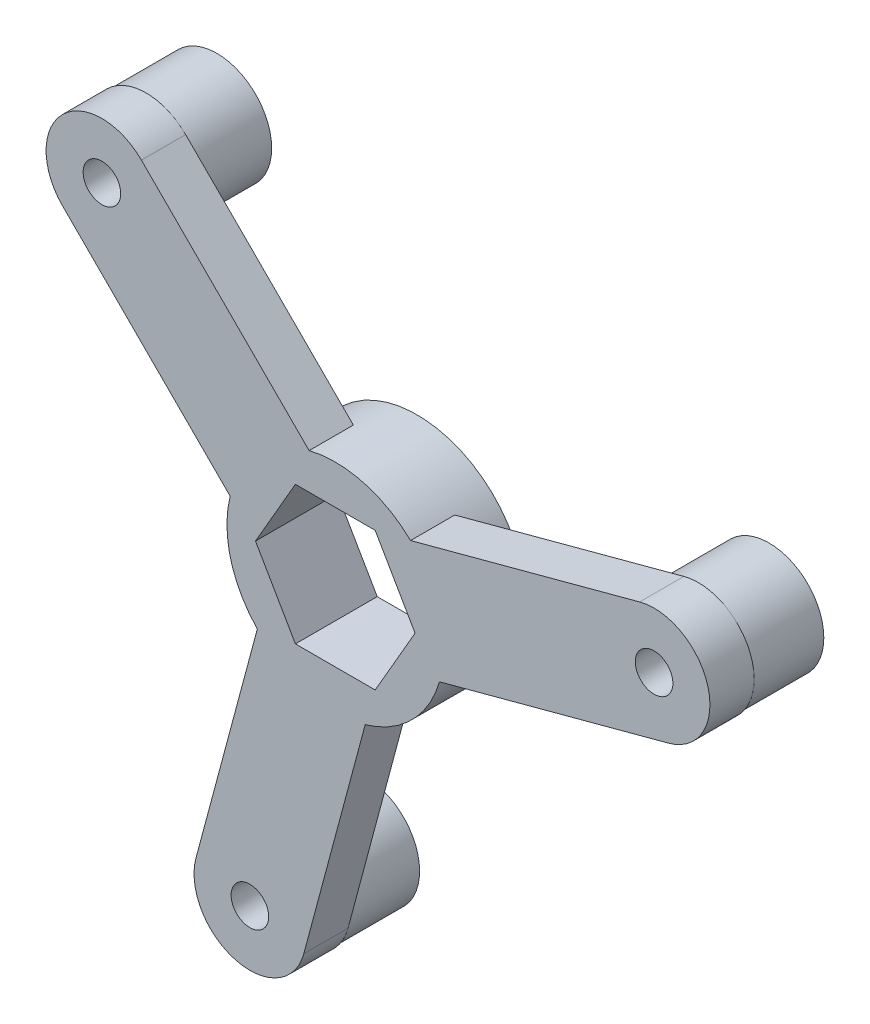
from build123d import *

# Parameters (mm, degrees)
F_01_START                                = 3
S01_HEX_COUPLING_BOSS_R                   = 9.8
F_01_HEX_COUPLING_BOSS_DEPTH              = 7.4
F_02_START                                = 6.4
F_02_DRIVE_SPOKE_1_DEPTH                  = 4
S03_FLANGE_STANDOFF_1_R                   = 4.95
F_03_FLANGE_STANDOFF_1_DEPTH              = 6.4
F_04_START                                = 6.4
F_04_DRIVE_SPOKE_2_DEPTH                  = 4
S05_FLANGE_STANDOFF_2_R                   = 4.95
F_05_FLANGE_STANDOFF_2_DEPTH              = 6.4
F_06_START                                = 6.4
F_06_DRIVE_SPOKE_3_DEPTH                  = 4
S07_FLANGE_STANDOFF_3_R                   = 4.95
F_07_FLANGE_STANDOFF_3_DEPTH              = 6.4
F_08_START                                = 0.1
F_08_FLOATING_12_MM_AF_DRIVE_SOCKET_DEPTH = 10.6
F_09_START                                = -0.1
S09_THREE_SHARED_THROUGH_FASTENERS_R      = 1.7
F_09_THREE_SHARED_THROUGH_FASTENERS_DEPTH = 10.6


with BuildPart() as part:
    # S01 - Hex coupling boss → 01 - Hex coupling boss (new body)
    with BuildSketch(Plane.XY.offset(F_01_START)):
        Circle(S01_HEX_COUPLING_BOSS_R)
    extrude(amount=F_01_HEX_COUPLING_BOSS_DEPTH)

    # S02 - Drive spoke 1 → 02 - Drive spoke 1 (add)
    with BuildSketch(Plane.XY.offset(F_02_START)):
        with BuildLine():
            Line((5.901185301, 6.809362547), (27.525849737, 12.603673919))
            ThreePointArc((27.525849737, 12.603673919), (33.710811337, 9.032784674), (30.139922092, 2.847823074))
            Line((30.139922092, 2.847823074), (8.515257656, -2.946488299))
            ThreePointArc((8.515257656, -2.946488299), (2.330296056, 0.624400946), (5.901185301, 6.809362547))
        make_face()
    extrude(amount=F_02_DRIVE_SPOKE_1_DEPTH)

    # S03 - Flange standoff 1 → 03 - Flange standoff 1 (add)
    with BuildSketch(Plane.XY):
        with Locations((28.832885915, 7.725748496)):
            Circle(S03_FLANGE_STANDOFF_1_R)
    extrude(amount=F_03_FLANGE_STANDOFF_1_DEPTH)

    # S04 - Drive spoke 2 → 04 - Drive spoke 2 (add)
    with BuildSketch(Plane.XY.offset(F_04_START)):
        with BuildLine():
            Line((-8.8476736, 1.70589511), (-24.678026663, 17.536248173))
            ThreePointArc((-24.678026663, 17.536248173), (-24.678026663, 24.678026663), (-17.536248173, 24.678026663))
            Line((-17.536248173, 24.678026663), (-1.70589511, 8.8476736))
            ThreePointArc((-1.70589511, 8.8476736), (-1.70589511, 1.70589511), (-8.8476736, 1.70589511))
        make_face()
    extrude(amount=F_04_DRIVE_SPOKE_2_DEPTH)

    # S05 - Flange standoff 2 → 05 - Flange standoff 2 (add)
    with BuildSketch(Plane.XY):
        with Locations((-21.107137418, 21.107137418)):
            Circle(S05_FLANGE_STANDOFF_2_R)
    extrude(amount=F_05_FLANGE_STANDOFF_2_DEPTH)

    # S06 - Drive spoke 3 → 06 - Drive spoke 3 (add)
    with BuildSketch(Plane.XY.offset(F_06_START)):
        with BuildLine():
            Line((2.946488299, -8.515257656), (-2.847823074, -30.139922092))
            ThreePointArc((-2.847823074, -30.139922092), (-9.032784674, -33.710811337), (-12.603673919, -27.525849737))
            Line((-12.603673919, -27.525849737), (-6.809362547, -5.901185301))
            ThreePointArc((-6.809362547, -5.901185301), (-0.624400946, -2.330296056), (2.946488299, -8.515257656))
        make_face()
    extrude(amount=F_06_DRIVE_SPOKE_3_DEPTH)

    # S07 - Flange standoff 3 → 07 - Flange standoff 3 (add)
    with BuildSketch(Plane.XY):
        with Locations((-7.725748496, -28.832885915)):
            Circle(S07_FLANGE_STANDOFF_3_R)
    extrude(amount=F_07_FLANGE_STANDOFF_3_DEPTH)

    # S08 - Floating 12 mm AF drive socket → 08 - Floating 12 mm AF drive socket (cut)
    with BuildSketch(Plane.XY.offset(F_08_START)):
        Polygon((7.216878365, 0), (3.608439182, 6.25), (-3.608439182, 6.25), (-7.216878365, 0), (-3.608439182, -6.25), (3.608439182, -6.25), align=None)
    extrude(amount=F_08_FLOATING_12_MM_AF_DRIVE_SOCKET_DEPTH, mode=Mode.SUBTRACT)

    # S09 - Three shared through-fasteners → 09 - Three shared through-fasteners (cut)
    with BuildSketch(Plane.XY.offset(F_09_START)):
        with Locations((28.832885915, 7.725748496)):
            Circle(S09_THREE_SHARED_THROUGH_FASTENERS_R)
        with Locations((-21.107137418, 21.107137418)):
            Circle(S09_THREE_SHARED_THROUGH_FASTENERS_R)
        with Locations((-7.725748496, -28.832885915)):
            Circle(S09_THREE_SHARED_THROUGH_FASTENERS_R)
    extrude(amount=F_09_THREE_SHARED_THROUGH_FASTENERS_DEPTH, mode=Mode.SUBTRACT)


solid = part.part
